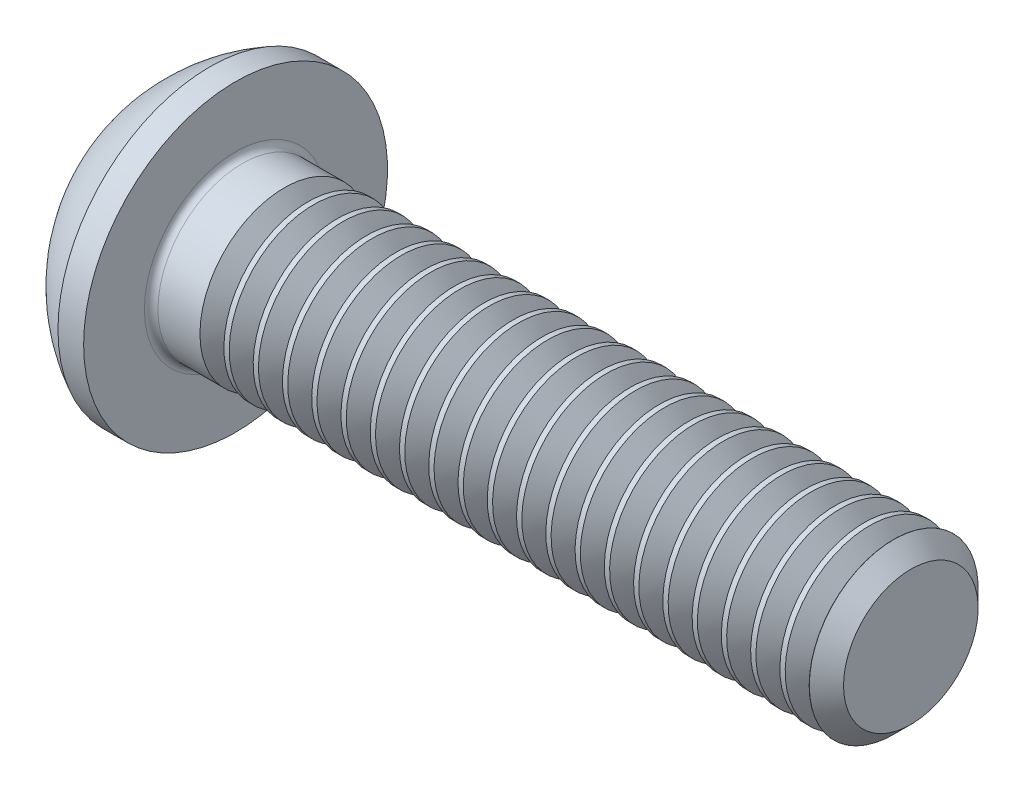
from build123d import *

# Parameters (mm, degrees)
FILLET1_R       = 0.1
HEX_2_DEPTH     = 0.8
THDSCHPAT_COUNT = 21
THDSCHPAT_PITCH = 0.433333333


with BuildPart() as part:
    # BodySke → BaseBody (revolve)
    with BuildSketch(Plane.XY, mode=Mode.PRIVATE) as basebody_sk:
        with BuildLine():
            Line((11.5, 0), (11.5, 0.9965))
            Line((11.5, 0.9965), (11.2465, 1.25))
            Line((11.2465, 1.25), (1.5, 1.25))
            Line((1.5, 1.25), (1.5, 2.25))
            Line((1.5, 2.25), (1.12, 2.25))
            ThreePointArc((1.12, 2.25), (0.469103821, 1.777992196), (0, 1.125))
            Line((0, 1.125), (0, 0))
            Line((0, 0), (11.5, 0))
        make_face()
    revolve(basebody_sk.sketch.rotate(Axis((0, 0, 0), (1, 0, 0)), 90), axis=Axis((0, 0, 0), (1, 0, 0)))

    # Fillet1
    fillet1_edges = [part.edges().sort_by_distance(p)[0] for p in [
        (1.5, 0, -1.25),
    ]]
    fillet(fillet1_edges, radius=FILLET1_R)

    # Sketch2 → PreBroach (revolve, cut)
    with BuildSketch(Plane.XY, mode=Mode.PRIVATE) as prebroach_sk:
        Polygon((0, 0.75), (0.8, 0.75), (1.233012702, 0), (0, 0), align=None)
    revolve(prebroach_sk.sketch.rotate(Axis((0, 0, 0), (1, 0, 0)), 90), axis=Axis((0, 0, 0), (1, 0, 0)), mode=Mode.SUBTRACT)

    # Sketch3 → Hex 2 (cut)
    with BuildSketch(Plane(origin=(0, 0, 0), x_dir=(0, 0, -1), z_dir=(1, 0, 0))):
        Polygon((-0.75, -0.433012702), (-0.75, 0.433012702), (0, 0.866025404), (0.75, 0.433012702), (0.75, -0.433012702), (0, -0.866025404), align=None)
    extrude(amount=HEX_2_DEPTH, mode=Mode.SUBTRACT)

    # ThdSchSke → ThreadSchematic (revolve, cut)
    with BuildSketch(Plane.XY, mode=Mode.PRIVATE) as threadschematic_sk:
        Polygon((2.4, -0.9965), (2.222497389, -1.25), (2.222497389, -1.5625), (2.577502611, -1.5625), (2.577502611, -1.25), align=None)
    threadschematic = revolve(threadschematic_sk.sketch.rotate(Axis((-3.175, 0, 0), (1, 0, 0)), 270), axis=Axis((-3.175, 0, 0), (1, 0, 0)), mode=Mode.SUBTRACT)

    # ThdSchPat: ThreadSchematic ×21
    with Locations(*[(i * THDSCHPAT_PITCH, 0, 0) for i in range(1, THDSCHPAT_COUNT)]):
        add(threadschematic, mode=Mode.SUBTRACT)


solid = part.part
